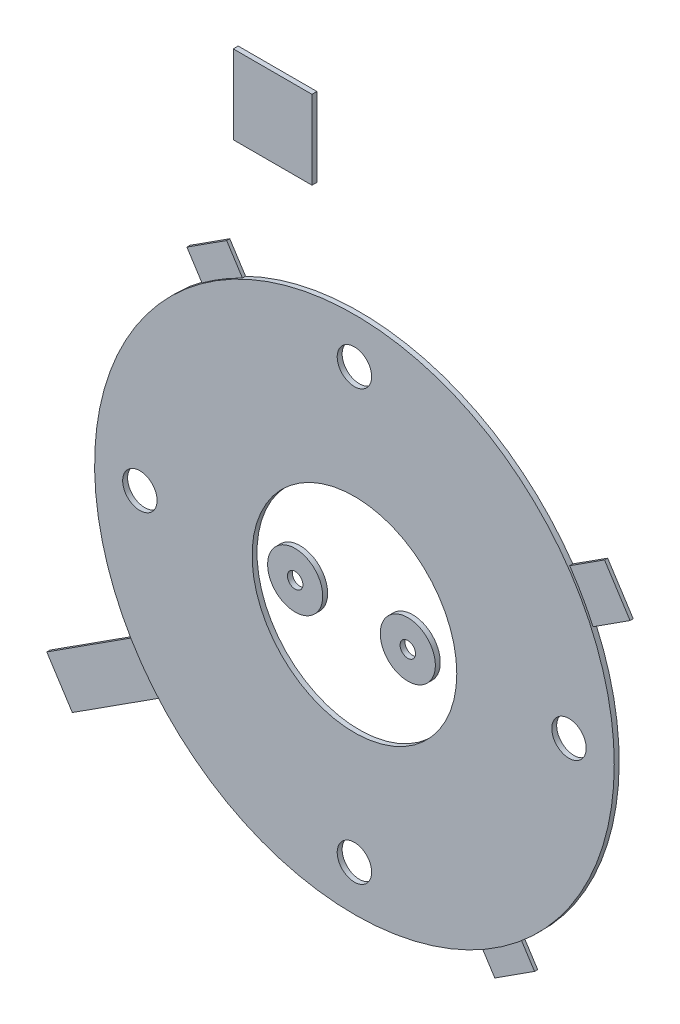
from build123d import *

# Parameters (mm, degrees)
SKETCH1_R             = 83.82
SKETCH1_R_2           = 33.02
SKETCH1_R_3           = 5.55625
BOSS_EXTRUDE1_DEPTH   = 1.5875
SKETCH2_R             = 8.89
SKETCH2_R_2           = 2.4892
BOSS_EXTRUDE2_DEPTH   = 1.5875
BOSS_EXTRUDE2_2_DEPTH = 1.5875
SKETCH2_W             = 25.4
SKETCH2_H             = 25.4
BOSS_EXTRUDE2_3_DEPTH = 1.5875
BOSS_EXTRUDE3_DEPTH   = 1.016


with BuildPart() as part:
    # Sketch1 → Boss-Extrude1 (new body)
    with BuildSketch(Plane.XY):
        Circle(SKETCH1_R)
        Circle(SKETCH1_R_2, mode=Mode.SUBTRACT)
        with Locations((-69.215, 0)):
            Circle(SKETCH1_R_3, mode=Mode.SUBTRACT)
        with Locations((0, 69.215)):
            Circle(SKETCH1_R_3, mode=Mode.SUBTRACT)
        with Locations((69.215, 0)):
            Circle(SKETCH1_R_3, mode=Mode.SUBTRACT)
        with Locations((0, -69.215)):
            Circle(SKETCH1_R_3, mode=Mode.SUBTRACT)
    extrude(amount=BOSS_EXTRUDE1_DEPTH)

    # Sketch3 → Boss-Extrude3 (add)
    with BuildSketch(Plane(origin=(0, 0, 0), x_dir=(-1, 0, 0), z_dir=(0, 0, -1))):
        Polygon((-58.593320115, 41.177009755), (-66.833750418, 28.356989925), (-88.345434116, 42.184232984), (-80.105003814, 55.004252814), align=None)
        Polygon((-48.527799881, -57.23355717), (-35.707780052, -65.473987472), (-44.711245717, -79.481096826), (-57.531265547, -71.240666524), align=None)
        Polygon((31.358470606, 67.049221054), (44.178490436, 58.808790751), (54.616620118, 75.047873493), (41.796600289, 83.288303795), align=None)
        Polygon((53.90809534, -31.13645663), (45.667665037, -43.95647646), (91.57402841, -73.464089774), (99.814458712, -60.644069945), align=None)
    extrude(amount=-BOSS_EXTRUDE3_DEPTH)


with BuildPart() as body_2:
    # Sketch2 → Boss-Extrude2 (new body)
    with BuildSketch(Plane(origin=(0, 0, 0), x_dir=(-1, 0, 0), z_dir=(0, 0, -1))):
        with Locations((-17.216545313, -1.138038116)):
            Circle(SKETCH2_R)
        with Locations((-17.216545313, -1.138038116)):
            Circle(SKETCH2_R_2, mode=Mode.SUBTRACT)
    extrude(amount=-BOSS_EXTRUDE2_DEPTH)


with BuildPart() as body_3:
    # Sketch2 → Boss-Extrude2 2 (new body)
    with BuildSketch(Plane(origin=(0, 0, 0), x_dir=(-1, 0, 0), z_dir=(0, 0, -1))):
        with Locations((19.115371157, 0)):
            Circle(SKETCH2_R)
        with Locations((19.115371157, 0)):
            Circle(SKETCH2_R_2, mode=Mode.SUBTRACT)
    extrude(amount=-BOSS_EXTRUDE2_2_DEPTH)


with BuildPart() as body_4:
    # Sketch2 → Boss-Extrude2 3 (new body)
    with BuildSketch(Plane(origin=(0, 0, 0), x_dir=(-1, 0, 0), z_dir=(0, 0, -1))):
        with Locations((26.390137184, 125.782482189)):
            Rectangle(SKETCH2_W, SKETCH2_H)
    extrude(amount=-BOSS_EXTRUDE2_3_DEPTH)


solid = Compound([part.part, body_2.part, body_3.part, body_4.part])
